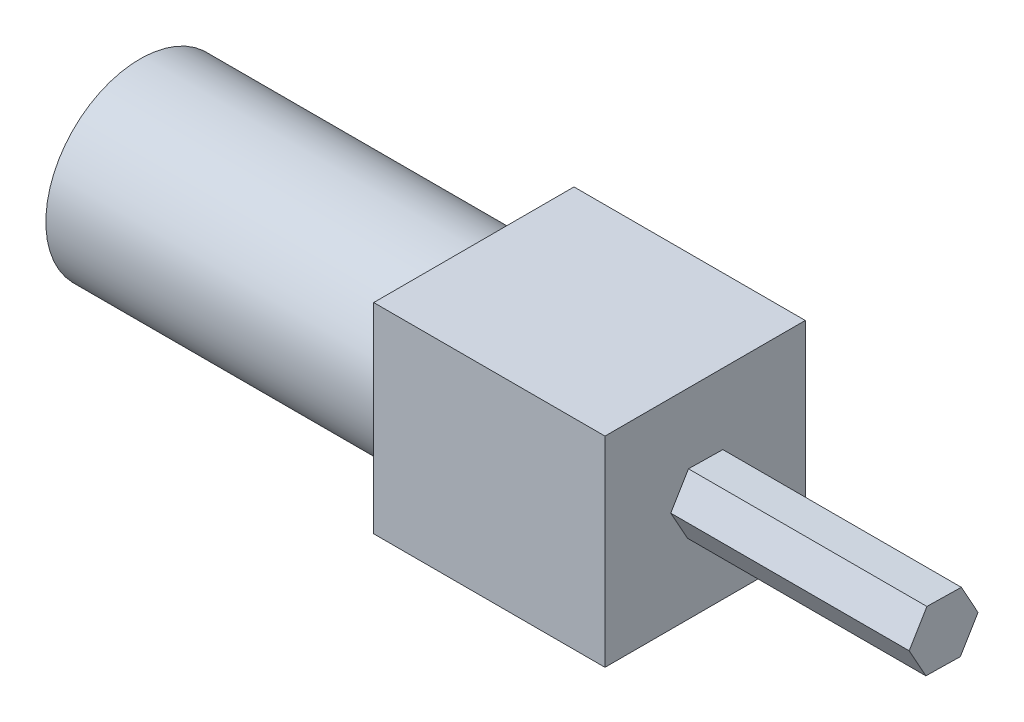
from build123d import *

# Parameters (mm, degrees)
SKETCH1_R           = 20.066
BOSS_EXTRUDE1_DEPTH = 71.12
SKETCH2_W           = 42.672
SKETCH2_H           = 42.672
BOSS_EXTRUDE2_DEPTH = 49.276
BOSS_EXTRUDE3_DEPTH = 50.8


with BuildPart() as part:
    # Sketch1 → Boss-Extrude1 (new body)
    with BuildSketch(Plane(origin=(0, 0, 0), x_dir=(0, 0, -1), z_dir=(1, 0, 0))):
        Circle(SKETCH1_R)
    extrude(amount=BOSS_EXTRUDE1_DEPTH)

    # Sketch2 → Boss-Extrude2 (add)
    with BuildSketch(Plane(origin=(71.12, 0, 0), x_dir=(0, 0, -1), z_dir=(1, 0, 0))):
        Rectangle(SKETCH2_W, SKETCH2_H)
    extrude(amount=BOSS_EXTRUDE2_DEPTH)

    # Sketch3 → Boss-Extrude3 (add)
    with BuildSketch(Plane(origin=(120.396, 0, 0), x_dir=(0, 0, -1), z_dir=(1, 0, 0))):
        Polygon((3.556221774, -6.412224265), (7.331259995, -0.126333735), (3.775038222, 6.28589053), (-3.556221774, 6.412224265), (-7.331259995, 0.126333735), (-3.775038222, -6.28589053), align=None)
    extrude(amount=BOSS_EXTRUDE3_DEPTH)


solid = part.part
